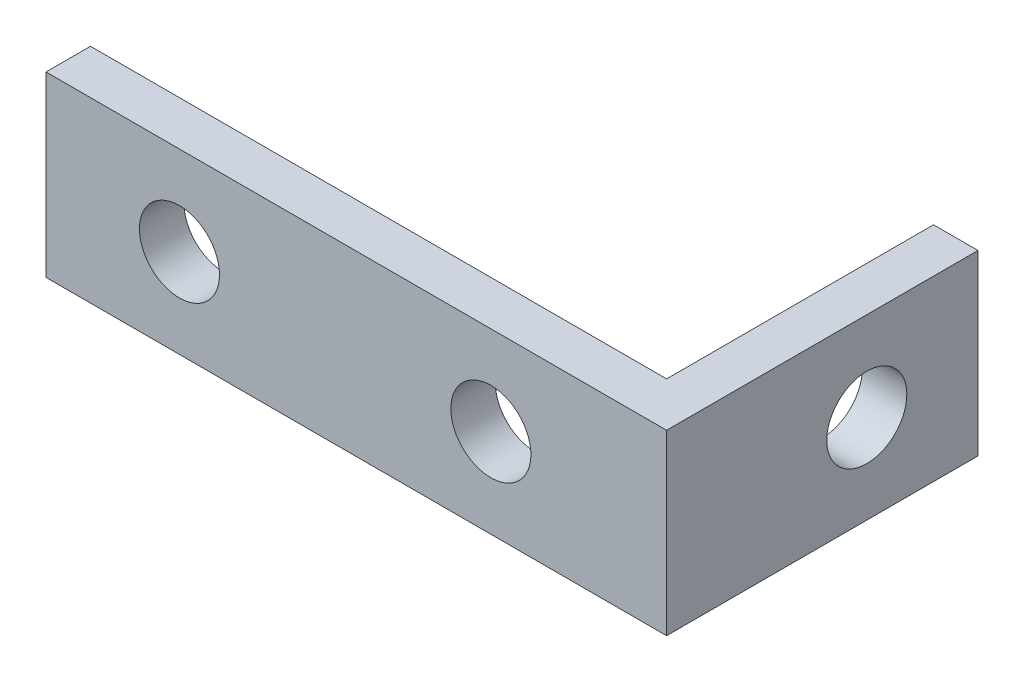
from build123d import *

# Parameters (mm, degrees)
SKETCH1_W                     = 69.75
SKETCH1_H                     = 35
BOSS_EXTRUDE1_DEPTH           = 20
SHELL1_T                      = -5
SKETCH2_R                     = 4.5
M8_CLEARANCE_9_MM_THRU_DEPTH  = 252.539423928
SKETCH3_R                     = 4.5
M8_CLEARANCE_9MM_THRU_2_DEPTH = 137.429775111


with BuildPart() as part:
    # Sketch1 → Boss-Extrude1 (new body)
    with BuildSketch(Plane(origin=(0, 74.0933991, 0), x_dir=(1, 0, 0), z_dir=(0, 1, 0))):
        with Locations((-203.625, -77.002324027)):
            Rectangle(SKETCH1_W, SKETCH1_H)
    extrude(amount=-BOSS_EXTRUDE1_DEPTH)

    # Shell1
    shell1_openings = [part.faces().sort_by_distance(p)[0] for p in [
        (-203.625, 54.0933991, 77.002324027),
        (-203.625, 74.0933991, 77.002324027),
        (-238.5, 64.0933991, 77.002324027),
        (-203.625, 64.0933991, 59.502324027),
    ]]
    offset(amount=SHELL1_T, openings=shell1_openings, kind=Kind.INTERSECTION)

    # Sketch2 → M8 clearance - 9 mm thru (cut, through all)
    with BuildSketch(Plane(origin=(0, 0, 89.502324027), x_dir=(-1, 0, 0), z_dir=(0, 0, -1))):
        with Locations(Location((188.5, 64.0933991, 0), (0, 0, 90))):
            Circle(SKETCH2_R)
        with Locations(Location((223.5, 64.0933991, 0), (0, 0, 90))):
            Circle(SKETCH2_R)
    extrude(amount=-M8_CLEARANCE_9_MM_THRU_DEPTH, mode=Mode.SUBTRACT)

    # Sketch3 → M8 Clearance - 9mm thru - 2 (cut, through all)
    with BuildSketch(Plane.ZY.offset(173.75)):
        with Locations(Location((72.002324027, 64.0933991, 0), (0, 0, 270))):
            Circle(SKETCH3_R)
    extrude(amount=-M8_CLEARANCE_9MM_THRU_2_DEPTH, mode=Mode.SUBTRACT)


solid = part.part
